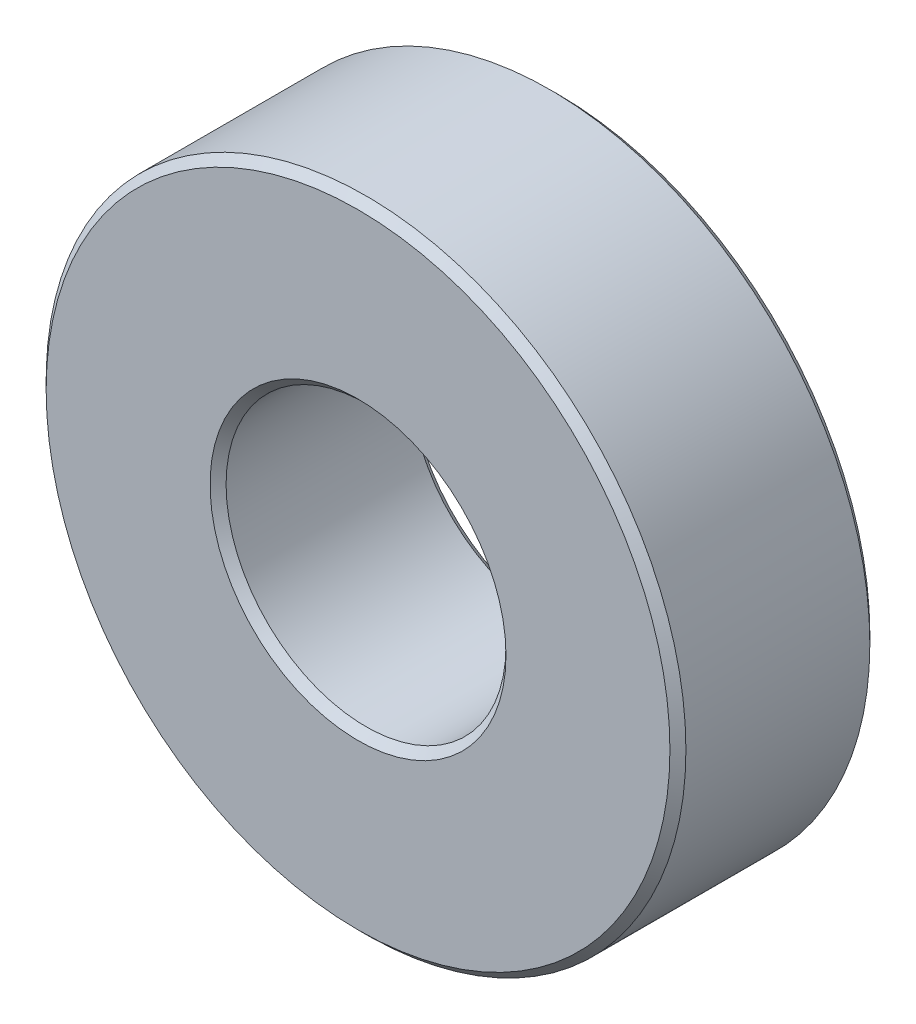
from build123d import *

# Parameters (mm, degrees)
ESQUISSE1_R          = 8
ESQUISSE1_R_2        = 3.5
BASE_EXTRUSION_DEPTH = 5
CHANFREIN1_SIZE      = 0.2


with BuildPart() as part:
    # Esquisse1 → Base-Extrusion (new body)
    with BuildSketch(Plane.XY):
        Circle(ESQUISSE1_R)
        Circle(ESQUISSE1_R_2, mode=Mode.SUBTRACT)
    extrude(amount=BASE_EXTRUSION_DEPTH)

    # Chanfrein1
    chanfrein1_edges = [part.edges().sort_by_distance(p)[0] for p in [
        (-8, 0, 0),
        (-8, 0, 5),
        (-3.5, 0, 0),
        (-3.5, 0, 5),
    ]]
    chamfer(chanfrein1_edges, length=CHANFREIN1_SIZE)


solid = part.part
